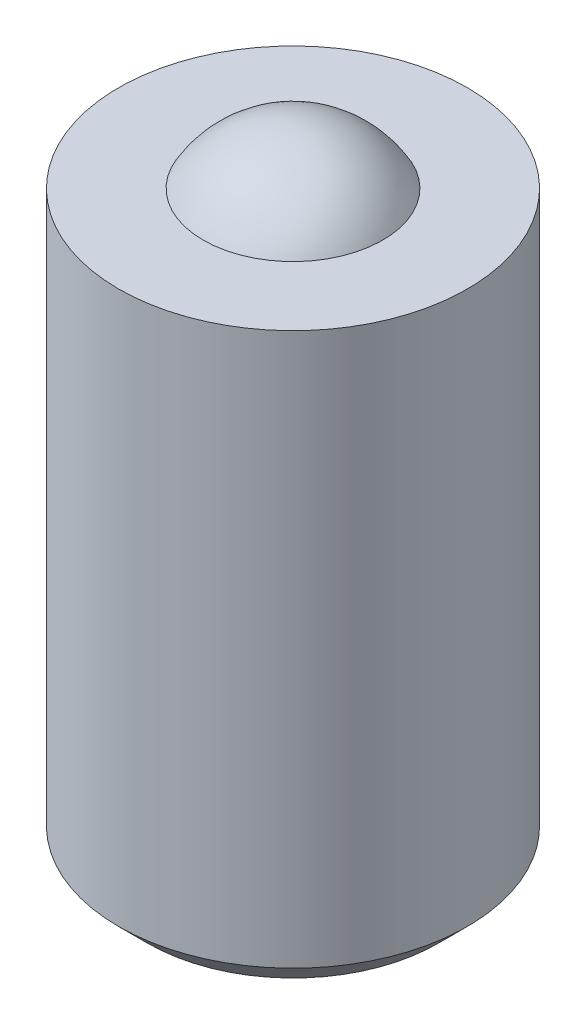
from build123d import *

# Parameters (mm, degrees)
CUT_EXTRUDE_1_DEPTH = 3


with BuildPart() as part:
    # 草图1 → 旋转1 (revolve)
    with BuildSketch(Plane(origin=(0, 0, 0), x_dir=(0, 0, -1), z_dir=(1, 0, 0))):
        with BuildLine():
            Line((-3.088689042, 0), (-6, 0))
            Line((-6, 0), (-6, -19))
            Line((-6, -19), (-5, -20))
            Line((-5, -20), (0, -20))
            Line((0, -20), (0, 1.8))
            ThreePointArc((0, 1.8), (-1.787456293, 1.317164815), (-3.088689042, 0))
        make_face()
    revolve(axis=Axis((0, 46.298402486, 0), (0, -1, 0)))

    # 草图2 → 切除-拉伸1 (cut)
    with BuildSketch(Plane.XZ.offset(20)):
        Polygon((0, 3.464101615), (-3, 1.732050808), (-3, -1.732050808), (0, -3.464101615), (3, -1.732050808), (3, 1.732050808), align=None)
    extrude(amount=-CUT_EXTRUDE_1_DEPTH, mode=Mode.SUBTRACT)


solid = part.part
